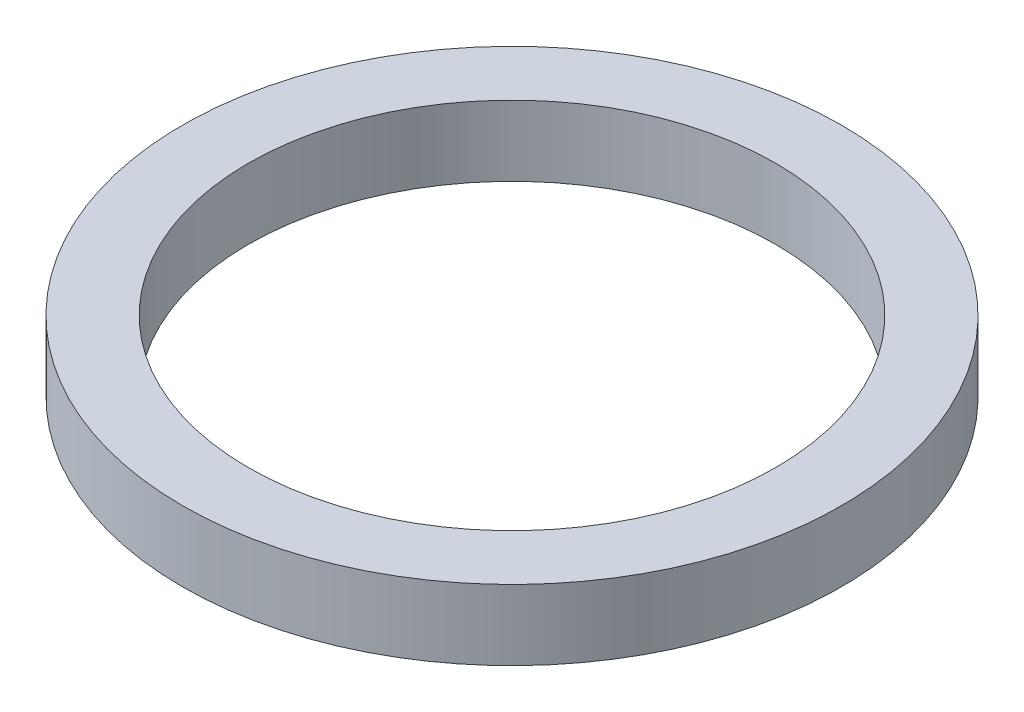
from build123d import *

# Parameters (mm, degrees)
SKETCH1_R           = 75
SKETCH1_R_2         = 60
BOSS_EXTRUDE1_DEPTH = 16


with BuildPart() as part:
    # Sketch1 → Boss-Extrude1 (new body)
    with BuildSketch(Plane(origin=(0, 0, 0), x_dir=(1, 0, 0), z_dir=(0, 1, 0))):
        with Locations(Location((0, 0, 0), (0, 0, 270))):
            Circle(SKETCH1_R)
        with Locations(Location((0, 0, 0), (0, 0, 270))):
            Circle(SKETCH1_R_2, mode=Mode.SUBTRACT)
    extrude(amount=BOSS_EXTRUDE1_DEPTH)


solid = part.part
